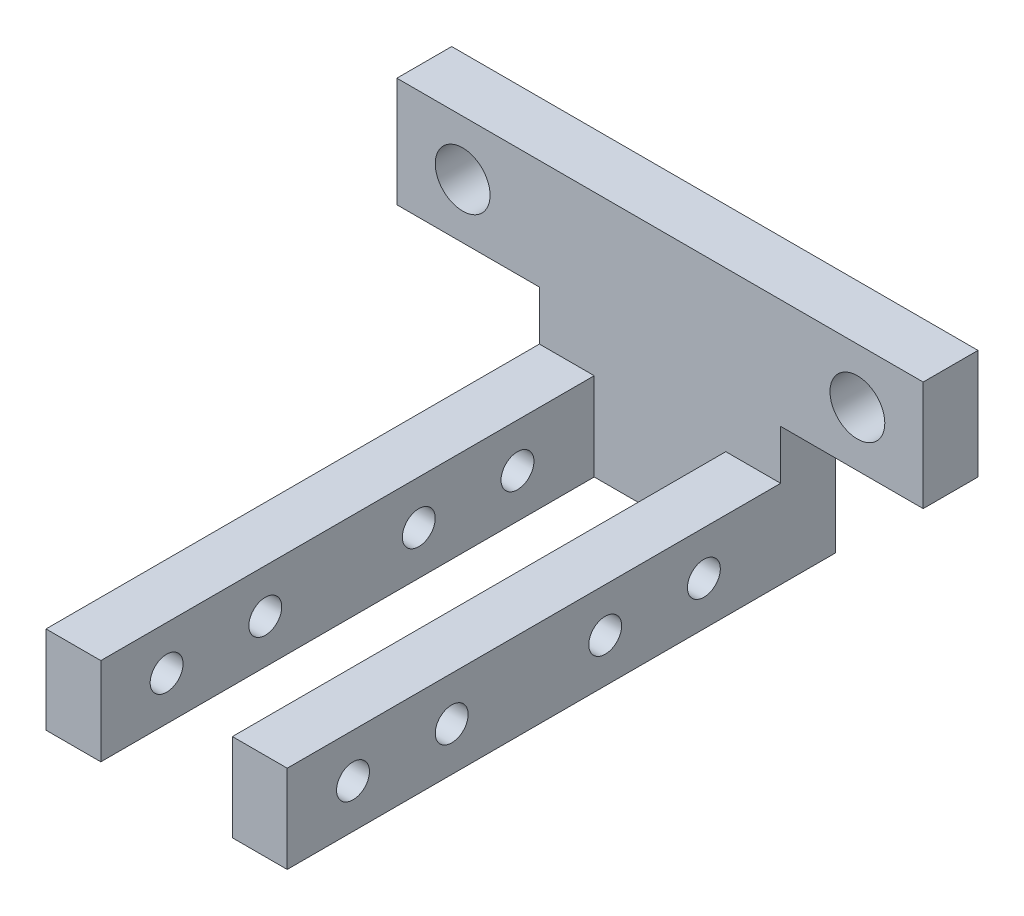
from build123d import *

# Parameters (mm, degrees)
SKETCH_1_R          = 2.5
SKETCH_1_W          = 22
SKETCH_1_H          = 12.5
SKETCH_1_H_2        = 5
EXTRUDE_2_DEPTH     = 5
SKETCH_2_W          = 5
SKETCH_2_H          = 8
EXTRUDE_3_DEPTH     = 45
SKETCH_3_R          = 1.5
CUT_EXTRUDE_1_DEPTH = 45
SKETCH_5_R          = 1.5
CUT_EXTRUDE_2_DEPTH = 45


with BuildPart() as part:
    # 草图1 → 凸台-拉伸2 (new body)
    # profile 1 of 3: a face of its own
    with BuildSketch(Plane.XY):
        Polygon((29.983914209, 11.388739946), (-18.016085791, 11.388739946), (-18.016085791, 1.388739946), (-5.016085791, 1.388739946), (-5.016085791, 6.388739946), (16.983914209, 6.388739946), (16.983914209, 1.388739946), (29.983914209, 1.388739946), align=None)
        with Locations((-12.016085791, 6.388739946)):
            Circle(SKETCH_1_R, mode=Mode.SUBTRACT)
        with Locations((23.983914209, 6.388739946)):
            Circle(SKETCH_1_R, mode=Mode.SUBTRACT)
    # profile 2 of 3: a face of its own
    with BuildSketch(Plane.XY):
        with Locations((5.983914209, -4.861260054)):
            Rectangle(SKETCH_1_W, SKETCH_1_H)
    # profile 3 of 3: a face of its own
    with BuildSketch(Plane.XY):
        with Locations((5.983914209, 3.888739946)):
            Rectangle(SKETCH_1_W, SKETCH_1_H_2)
    extrude(amount=EXTRUDE_2_DEPTH)

    # 草图2 → 凸台-拉伸3 (add)
    with BuildSketch(Plane.XY.offset(5)):
        with Locations((-2.516085791, -7.111260054)):
            Rectangle(SKETCH_2_W, SKETCH_2_H)
        with Locations((14.483914209, -7.111260054)):
            Rectangle(SKETCH_2_W, SKETCH_2_H)
    extrude(amount=EXTRUDE_3_DEPTH)

    # 草图3 → 切除-拉伸1 (cut)
    with BuildSketch(Plane.ZY.offset(5.016085791)):
        with Locations(Location((21, -7.111260054, 0), (0, 0, 270))):
            Circle(SKETCH_3_R)
        with Locations(Location((35, -7.111260054, 0), (0, 0, 270))):
            Circle(SKETCH_3_R)
    extrude(amount=-CUT_EXTRUDE_1_DEPTH, mode=Mode.SUBTRACT)

    # 草图5 → 切除-拉伸2 (cut)
    with BuildSketch(Plane.ZY.offset(5.016085791)):
        with Locations(Location((44, -7.111260054, 0), (0, 0, 270))):
            Circle(SKETCH_5_R)
        with Locations(Location((12, -7.111260054, 0), (0, 0, 270))):
            Circle(SKETCH_5_R)
    extrude(amount=-CUT_EXTRUDE_2_DEPTH, mode=Mode.SUBTRACT)


solid = part.part
